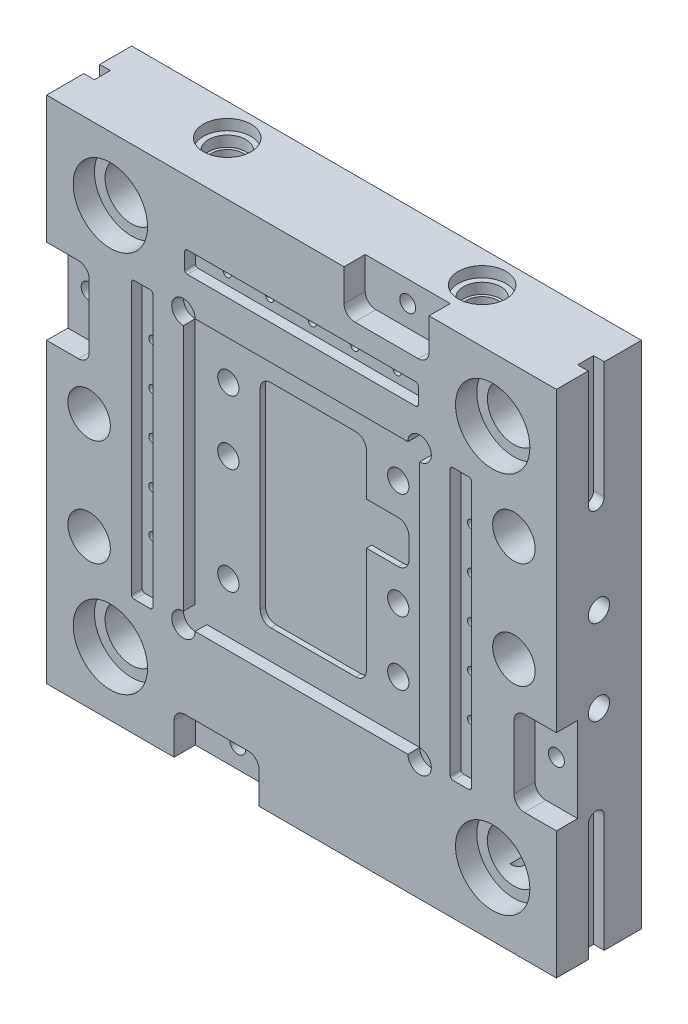
from build123d import *

# Parameters (mm, degrees)
SKETCH1_W           = 304.8
SKETCH1_H           = 304.8
BASE_EXTRUDE_DEPTH  = 50.8
CUT_EXTRUDE1_DEPTH  = 7.0358
SKETCH3_R           = 15.875
CUT_EXTRUDE2_DEPTH  = 222.432066332
SKETCH4_R           = 22.225
CUT_EXTRUDE3_DEPTH  = 12.7
CUT_EXTRUDE4_DEPTH  = 12.7
SKETCH6_R           = 6.35
CUT_EXTRUDE5_DEPTH  = 220.924589807
SKETCH7_R           = 11.1125
CUT_EXTRUDE6_DEPTH  = 12.7
SKETCH8_R           = 4.7625
CUT_EXTRUDE7_DEPTH  = 219.867836833
CUT_EXTRUDE9_DEPTH  = 6.35
CUT_EXTRUDE10_DEPTH = 6.35
CUT_EXTRUDE11_DEPTH = 6.35
SKETCH12_R          = 2.38125
CUT_EXTRUDE12_DEPTH = 221.06208783
SKETCH13_R          = 6.35
CUT_EXTRUDE13_DEPTH = 25.4
SKETCH14_R          = 5.209312424
CUT_EXTRUDE14_DEPTH = 5.08
SKETCH15_R          = 12.7
CUT_EXTRUDE15_DEPTH = 19.05
SKETCH16_R          = 3.175
CUT_EXTRUDE16_DEPTH = 25.4
CUT_EXTRUDE17_DEPTH = 3.175
SKETCH18_R          = 9.525
CUT_EXTRUDE18_DEPTH = 241.046
SKETCH19_R          = 11.1125
CUT_EXTRUDE19_DEPTH = 12.7
SKETCH20_R          = 14.2875
CUT_EXTRUDE20_DEPTH = 6.35
CUT_EXTRUDE21_START = -12.7
SKETCH21_R          = 11.1125
CUT_EXTRUDE21_DEPTH = 12.7
CUT_EXTRUDE22_START = -6.35
SKETCH22_R          = 14.2875
CUT_EXTRUDE22_DEPTH = 6.35
SKETCH23_R          = 6.35
CUT_EXTRUDE23_DEPTH = 25.4
CUT_EXTRUDE24_START = -25.4
SKETCH24_R          = 6.35
CUT_EXTRUDE24_DEPTH = 25.4
CUT_EXTRUDE25_START = -50.8
SKETCH25_R          = 9.525
CUT_EXTRUDE25_DEPTH = 50.8


with BuildPart() as part:
    # Sketch1 → Base-Extrude (new body)
    with BuildSketch(Plane.XY):
        Rectangle(SKETCH1_W, SKETCH1_H)
    extrude(amount=-BASE_EXTRUDE_DEPTH)

    # Sketch2 → Cut-Extrude1 (cut)
    with BuildSketch(Plane.XY):
        with BuildLine():
            Line((-63.618705456, 80.9371), (63.618705456, 80.9371))
            ThreePointArc((63.618705456, 80.9371), (75.557005995, 85.882105995), (70.612, 73.943805456))
            Line((70.612, 73.943805456), (70.612, -73.943805456))
            ThreePointArc((70.612, -73.943805456), (75.557005995, -85.882105995), (63.618705456, -80.9371))
            Line((63.618705456, -80.9371), (-63.618705456, -80.9371))
            ThreePointArc((-63.618705456, -80.9371), (-75.557005995, -85.882105995), (-70.612, -73.943805456))
            Line((-70.612, -73.943805456), (-70.612, 73.943805456))
            ThreePointArc((-70.612, 73.943805456), (-75.557005995, 85.882105995), (-63.618705456, 80.9371))
        make_face()
    extrude(amount=-CUT_EXTRUDE1_DEPTH, mode=Mode.SUBTRACT)

    # Sketch3 → Cut-Extrude2 (cut, through all)
    with BuildSketch(Plane.XY):
        with Locations((-114.3, 114.3)):
            Circle(SKETCH3_R)
        with Locations((114.3, 114.3)):
            Circle(SKETCH3_R)
        with Locations((114.3, -114.3)):
            Circle(SKETCH3_R)
        with Locations((-114.3, -114.3)):
            Circle(SKETCH3_R)
    extrude(amount=-CUT_EXTRUDE2_DEPTH, mode=Mode.SUBTRACT)

    # Sketch4 → Cut-Extrude3 (cut)
    with BuildSketch(Plane.XY):
        with Locations((-114.3, 114.3)):
            Circle(SKETCH4_R)
        with Locations((114.3, 114.3)):
            Circle(SKETCH4_R)
        with Locations((114.3, -114.3)):
            Circle(SKETCH4_R)
        with Locations((-114.3, -114.3)):
            Circle(SKETCH4_R)
    extrude(amount=-CUT_EXTRUDE3_DEPTH, mode=Mode.SUBTRACT)

    # Sketch5 → Cut-Extrude4 (cut)
    with BuildSketch(Plane.XY):
        with BuildLine():
            Line((-76.2, -158.75), (-25.4, -158.75))
            Line((-25.4, -158.75), (-25.4, -133.35))
            ThreePointArc((-25.4, -133.35), (-27.259871939, -128.859871939), (-31.75, -127))
            Line((-31.75, -127), (-69.85, -127))
            ThreePointArc((-69.85, -127), (-74.340128061, -128.859871939), (-76.2, -133.35))
            Line((-76.2, -133.35), (-76.2, -158.75))
        make_face()
        with BuildLine():
            Line((76.2, 158.75), (25.4, 158.75))
            Line((25.4, 158.75), (25.4, 133.35))
            ThreePointArc((25.4, 133.35), (27.259871939, 128.859871939), (31.75, 127))
            Line((31.75, 127), (69.85, 127))
            ThreePointArc((69.85, 127), (74.340128061, 128.859871939), (76.2, 133.35))
            Line((76.2, 133.35), (76.2, 158.75))
        make_face()
        with BuildLine():
            Line((158.75, -76.2), (133.35, -76.2))
            ThreePointArc((133.35, -76.2), (128.859871939, -74.340128061), (127, -69.85))
            Line((127, -69.85), (127, -31.75))
            ThreePointArc((127, -31.75), (128.859871939, -27.259871939), (133.35, -25.4))
            Line((133.35, -25.4), (158.75, -25.4))
            Line((158.75, -25.4), (158.75, -76.2))
        make_face()
        with BuildLine():
            Line((-165.1, 76.2), (-133.35, 76.2))
            ThreePointArc((-133.35, 76.2), (-128.859871939, 74.340128061), (-127, 69.85))
            Line((-127, 69.85), (-127, 31.75))
            ThreePointArc((-127, 31.75), (-128.859871939, 27.259871939), (-133.35, 25.4))
            Line((-133.35, 25.4), (-165.1, 25.4))
            Line((-165.1, 25.4), (-165.1, 76.2))
        make_face()
    extrude(amount=-CUT_EXTRUDE4_DEPTH, mode=Mode.SUBTRACT)

    # Sketch6 → Cut-Extrude5 (cut, through all)
    with BuildSketch(Plane.XY.offset(-7.0358)):
        with Locations((-50.8, 50.8)):
            Circle(SKETCH6_R)
        with Locations((50.8, 50.8)):
            Circle(SKETCH6_R)
        with Locations((50.8, -50.8)):
            Circle(SKETCH6_R)
        with Locations((-50.8, -50.8)):
            Circle(SKETCH6_R)
        with Locations((-50.8, 12.7)):
            Circle(SKETCH6_R)
        with Locations((50.8, -12.7)):
            Circle(SKETCH6_R)
    extrude(amount=-CUT_EXTRUDE5_DEPTH, mode=Mode.SUBTRACT)

    # Sketch7 → Cut-Extrude6 (cut)
    with BuildSketch(Plane(origin=(0, 0, -50.8), x_dir=(-1, 0, 0), z_dir=(0, 0, -1))):
        with Locations((-50.8, 50.8)):
            Circle(SKETCH7_R)
        with Locations((-50.8, -50.8)):
            Circle(SKETCH7_R)
        with Locations((50.8, -50.8)):
            Circle(SKETCH7_R)
        with Locations((50.8, 50.8)):
            Circle(SKETCH7_R)
    extrude(amount=-CUT_EXTRUDE6_DEPTH, mode=Mode.SUBTRACT)

    # Sketch8 → Cut-Extrude7 (cut, through all)
    with BuildSketch(Plane.XY.offset(-12.7)):
        with Locations((-50.8, -139.7)):
            Circle(SKETCH8_R)
        with Locations((-139.7, 50.8)):
            Circle(SKETCH8_R)
        with Locations((50.8, 139.7)):
            Circle(SKETCH8_R)
        with Locations((139.7, -50.8)):
            Circle(SKETCH8_R)
    extrude(amount=-CUT_EXTRUDE7_DEPTH, mode=Mode.SUBTRACT)

    # Sketch9 → Cut-Extrude9 (cut)
    with BuildSketch(Plane(origin=(152.4, 0, 0), x_dir=(0, 0, -1), z_dir=(1, 0, 0))):
        with BuildLine():
            Line((28.6004, -82.55), (28.6004, -158.75))
            Line((28.6004, -158.75), (19.05, -158.75))
            Line((19.05, -158.75), (19.05, -82.55))
            ThreePointArc((19.05, -82.55), (23.8252, -77.7748), (28.6004, -82.55))
        make_face()
        with BuildLine():
            Line((19.05, 158.75), (28.6004, 158.75))
            Line((28.6004, 158.75), (28.6004, 82.55))
            ThreePointArc((28.6004, 82.55), (23.8252, 77.7748), (19.05, 82.55))
            Line((19.05, 82.55), (19.05, 158.75))
        make_face()
    extrude(amount=-CUT_EXTRUDE9_DEPTH, mode=Mode.SUBTRACT)

    # Sketch10 → Cut-Extrude10 (cut)
    with BuildSketch(Plane.ZY.offset(152.4)):
        with BuildLine():
            Line((-30.1625, -82.55), (-30.1625, -158.75))
            Line((-30.1625, -158.75), (-20.6375, -158.75))
            Line((-20.6375, -158.75), (-20.6375, -82.55))
            ThreePointArc((-20.6375, -82.55), (-25.4, -77.7875), (-30.1625, -82.55))
        make_face()
        with BuildLine():
            Line((-22.225, 165.1), (-31.75, 165.1))
            Line((-31.75, 165.1), (-31.75, 82.5246))
            ThreePointArc((-31.75, 82.5246), (-26.9875, 77.7621), (-22.225, 82.5246))
            Line((-22.225, 82.5246), (-22.225, 165.1))
        make_face()
    extrude(amount=-CUT_EXTRUDE10_DEPTH, mode=Mode.SUBTRACT)

    # Sketch11 → Cut-Extrude11 (cut)
    with BuildSketch(Plane.XY):
        with BuildLine():
            Line((90.4875, 80.9625), (100.0125, 80.9625))
            ThreePointArc((100.0125, 80.9625), (101.135032015, 80.497532015), (101.6, 79.375))
            Line((101.6, 79.375), (101.6, -79.375))
            ThreePointArc((101.6, -79.375), (101.135032015, -80.497532015), (100.0125, -80.9625))
            Line((100.0125, -80.9625), (90.4875, -80.9625))
            ThreePointArc((90.4875, -80.9625), (89.364967985, -80.497532015), (88.9, -79.375))
            Line((88.9, -79.375), (88.9, 79.375))
            ThreePointArc((88.9, 79.375), (89.364967985, 80.497532015), (90.4875, 80.9625))
        make_face()
        with BuildLine():
            Line((-90.4875, 82.55), (-100.0125, 82.55))
            ThreePointArc((-100.0125, 82.55), (-101.135032015, 82.085032015), (-101.6, 80.9625))
            Line((-101.6, 80.9625), (-101.6, -80.9625))
            ThreePointArc((-101.6, -80.9625), (-101.135032015, -82.085032015), (-100.0125, -82.55))
            Line((-100.0125, -82.55), (-90.4875, -82.55))
            ThreePointArc((-90.4875, -82.55), (-89.364967985, -82.085032015), (-88.9, -80.9625))
            Line((-88.9, -80.9625), (-88.9, 80.9625))
            ThreePointArc((-88.9, 80.9625), (-89.364967985, 82.085032015), (-90.4875, 82.55))
        make_face()
        with BuildLine():
            Line((-68.2625, 101.6), (68.2625, 101.6))
            ThreePointArc((68.2625, 101.6), (69.385032015, 102.064967985), (69.85, 103.1875))
            Line((69.85, 103.1875), (69.85, 112.7125))
            ThreePointArc((69.85, 112.7125), (69.385032015, 113.835032015), (68.2625, 114.3))
            Line((68.2625, 114.3), (-68.2625, 114.3))
            ThreePointArc((-68.2625, 114.3), (-69.385032015, 113.835032015), (-69.85, 112.7125))
            Line((-69.85, 112.7125), (-69.85, 103.1875))
            ThreePointArc((-69.85, 103.1875), (-69.385032015, 102.064967985), (-68.2625, 101.6))
        make_face()
    extrude(amount=-CUT_EXTRUDE11_DEPTH, mode=Mode.SUBTRACT)

    # Sketch12 → Cut-Extrude12 (cut, through all)
    with BuildSketch(Plane.XY.offset(-6.35)):
        with Locations((0, 107.95)):
            Circle(SKETCH12_R)
        with Locations((-25.4, 107.95)):
            Circle(SKETCH12_R)
        with Locations((-50.8, 107.95)):
            Circle(SKETCH12_R)
        with Locations((25.4, 107.95)):
            Circle(SKETCH12_R)
        with Locations((50.8, 107.95)):
            Circle(SKETCH12_R)
        with Locations((-95.25, 0)):
            Circle(SKETCH12_R)
        with Locations((-95.25, 25.4)):
            Circle(SKETCH12_R)
        with Locations((-95.25, 50.8)):
            Circle(SKETCH12_R)
        with Locations((-95.25, -25.4)):
            Circle(SKETCH12_R)
        with Locations((-95.25, -50.8)):
            Circle(SKETCH12_R)
        with Locations((95.25, 50.8)):
            Circle(SKETCH12_R)
        with Locations((95.25, 25.4)):
            Circle(SKETCH12_R)
        with Locations((95.25, 0)):
            Circle(SKETCH12_R)
        with Locations((95.25, -25.4)):
            Circle(SKETCH12_R)
        with Locations((95.25, -50.8)):
            Circle(SKETCH12_R)
    extrude(amount=-CUT_EXTRUDE12_DEPTH, mode=Mode.SUBTRACT)

    # Sketch13 → Cut-Extrude13 (cut)
    with BuildSketch(Plane.XZ.offset(152.4)):
        with Locations(Location((0, -25.4, 0), (0, 0, 270))):
            Circle(SKETCH13_R)
        with Locations(Location((101.6, -25.4, 0), (0, 0, 270))):
            Circle(SKETCH13_R)
        with Locations(Location((-101.6, -25.4, 0), (0, 0, 270))):
            Circle(SKETCH13_R)
    extrude(amount=-CUT_EXTRUDE13_DEPTH, mode=Mode.SUBTRACT)

    # Sketch14 → Cut-Extrude14 (cut)
    with BuildSketch(Plane(origin=(0, 0, -50.8), x_dir=(-1, 0, 0), z_dir=(0, 0, -1))):
        with Locations((-95.25, 50.8)):
            Circle(SKETCH14_R)
        with Locations((-95.25, 0)):
            Circle(SKETCH14_R)
        with Locations((-95.25, -50.8)):
            Circle(SKETCH14_R)
        with Locations((95.25, -50.8)):
            Circle(SKETCH14_R)
        with Locations((95.25, 0)):
            Circle(SKETCH14_R)
        with Locations((95.25, 50.8)):
            Circle(SKETCH14_R)
        with Locations((50.8, 107.95)):
            Circle(SKETCH14_R)
        with Locations((0, 107.95)):
            Circle(SKETCH14_R)
        with Locations((-50.8, 107.95)):
            Circle(SKETCH14_R)
    extrude(amount=-CUT_EXTRUDE14_DEPTH, mode=Mode.SUBTRACT)

    # Sketch15 → Cut-Extrude15 (cut)
    with BuildSketch(Plane.XY):
        with Locations((-127, 0)):
            Circle(SKETCH15_R)
        with Locations((-127, -63.5)):
            Circle(SKETCH15_R)
        with Locations((127, 0)):
            Circle(SKETCH15_R)
        with Locations((127, 63.5)):
            Circle(SKETCH15_R)
    extrude(amount=-CUT_EXTRUDE15_DEPTH, mode=Mode.SUBTRACT)

    # Sketch16 → Cut-Extrude16 (cut)
    with BuildSketch(Plane.XY.offset(-19.05)):
        with Locations((127, 63.5)):
            Circle(SKETCH16_R)
        with Locations((127, 0)):
            Circle(SKETCH16_R)
        with Locations((-127, 0)):
            Circle(SKETCH16_R)
        with Locations((-127, -63.5)):
            Circle(SKETCH16_R)
    extrude(amount=-CUT_EXTRUDE16_DEPTH, mode=Mode.SUBTRACT)

    # Sketch17 → Cut-Extrude17 (cut)
    with BuildSketch(Plane.XY.offset(-7.0358)):
        with BuildLine():
            Line((-25.4, 63.5), (25.4, 63.5))
            ThreePointArc((25.4, 63.5), (29.890128061, 61.640128061), (31.75, 57.15))
            Line((31.75, 57.15), (31.75, 31.75))
            Line((31.75, 31.75), (50.8, 31.75))
            ThreePointArc((50.8, 31.75), (55.290128061, 29.890128061), (57.15, 25.4))
            Line((57.15, 25.4), (57.15, 12.7))
            ThreePointArc((57.15, 12.7), (55.290128061, 8.209871939), (50.8, 6.35))
            Line((50.8, 6.35), (31.75, 6.35))
            Line((31.75, 6.35), (31.75, -57.15))
            ThreePointArc((31.75, -57.15), (29.890128061, -61.640128061), (25.4, -63.5))
            Line((25.4, -63.5), (-25.4, -63.5))
            ThreePointArc((-25.4, -63.5), (-29.890128061, -61.640128061), (-31.75, -57.15))
            Line((-31.75, -57.15), (-31.75, -31.75))
            Line((-31.75, -31.75), (-31.75, 57.15))
            ThreePointArc((-31.75, 57.15), (-29.890128061, 61.640128061), (-25.4, 63.5))
        make_face()
    extrude(amount=-CUT_EXTRUDE17_DEPTH, mode=Mode.SUBTRACT)

    # Sketch18 → Cut-Extrude18 (cut)
    with BuildSketch(Plane.XZ.offset(152.4)):
        with Locations(Location((-76.2, -31.7754, 0), (0, 0, 270))):
            Circle(SKETCH18_R)
        with Locations(Location((76.2, -31.7754, 0), (0, 0, 270))):
            Circle(SKETCH18_R)
    extrude(amount=-CUT_EXTRUDE18_DEPTH, mode=Mode.SUBTRACT)

    # Sketch19 → Cut-Extrude19 (cut)
    with BuildSketch(Plane.XZ.offset(152.4)):
        with Locations(Location((76.2, -31.7754, 0), (0, 0, 270))):
            Circle(SKETCH19_R)
        with Locations(Location((-76.2, -31.7754, 0), (0, 0, 270))):
            Circle(SKETCH19_R)
    extrude(amount=-CUT_EXTRUDE19_DEPTH, mode=Mode.SUBTRACT)

    # Sketch20 → Cut-Extrude20 (cut)
    with BuildSketch(Plane.XZ.offset(152.4)):
        with Locations(Location((76.2, -31.7754, 0), (0, 0, 270))):
            Circle(SKETCH20_R)
        with Locations(Location((-76.2, -31.7754, 0), (0, 0, 270))):
            Circle(SKETCH20_R)
    extrude(amount=-CUT_EXTRUDE20_DEPTH, mode=Mode.SUBTRACT)

    # Sketch21 → Cut-Extrude21 (cut)
    with BuildSketch(Plane(origin=(0, 152.4, 0), x_dir=(-1, 0, 0), z_dir=(0, 1, 0)).offset(CUT_EXTRUDE21_START)):
        with Locations(Location((-76.2, -31.7754, 0), (0, 0, 270))):
            Circle(SKETCH21_R)
        with Locations(Location((76.2, -31.7754, 0), (0, 0, 270))):
            Circle(SKETCH21_R)
    extrude(amount=CUT_EXTRUDE21_DEPTH, mode=Mode.SUBTRACT)

    # Sketch22 → Cut-Extrude22 (cut)
    with BuildSketch(Plane(origin=(0, 152.4, 0), x_dir=(-1, 0, 0), z_dir=(0, 1, 0)).offset(CUT_EXTRUDE22_START)):
        with Locations(Location((-76.2, -31.7754, 0), (0, 0, 270))):
            Circle(SKETCH22_R)
        with Locations(Location((76.2, -31.7754, 0), (0, 0, 270))):
            Circle(SKETCH22_R)
    extrude(amount=CUT_EXTRUDE22_DEPTH, mode=Mode.SUBTRACT)

    # Sketch23 → Cut-Extrude23 (cut)
    with BuildSketch(Plane(origin=(152.4, 0, 0), x_dir=(0, 0, -1), z_dir=(1, 0, 0))):
        with Locations((25.4, 25.4)):
            Circle(SKETCH23_R)
        with Locations((25.4, -25.4)):
            Circle(SKETCH23_R)
    extrude(amount=-CUT_EXTRUDE23_DEPTH, mode=Mode.SUBTRACT)

    # Sketch24 → Cut-Extrude24 (cut)
    with BuildSketch(Plane.ZY.offset(152.4).offset(CUT_EXTRUDE24_START)):
        with Locations(Location((-25.4, 25.4, 0), (0, 0, 180))):
            Circle(SKETCH24_R)
        with Locations(Location((-25.4, -25.4, 0), (0, 0, 180))):
            Circle(SKETCH24_R)
    extrude(amount=CUT_EXTRUDE24_DEPTH, mode=Mode.SUBTRACT)

    # Sketch25 → Cut-Extrude25 (cut)
    with BuildSketch(Plane(origin=(0, 139.7, 0), x_dir=(-1, 0, 0), z_dir=(0, 1, 0)).offset(CUT_EXTRUDE25_START)):
        with Locations(Location((-76.2, -31.7754, 0), (0, 0, 270))):
            Circle(SKETCH25_R)
        with Locations(Location((76.2, -31.7754, 0), (0, 0, 270))):
            Circle(SKETCH25_R)
    extrude(amount=CUT_EXTRUDE25_DEPTH, mode=Mode.SUBTRACT)


solid = part.part
